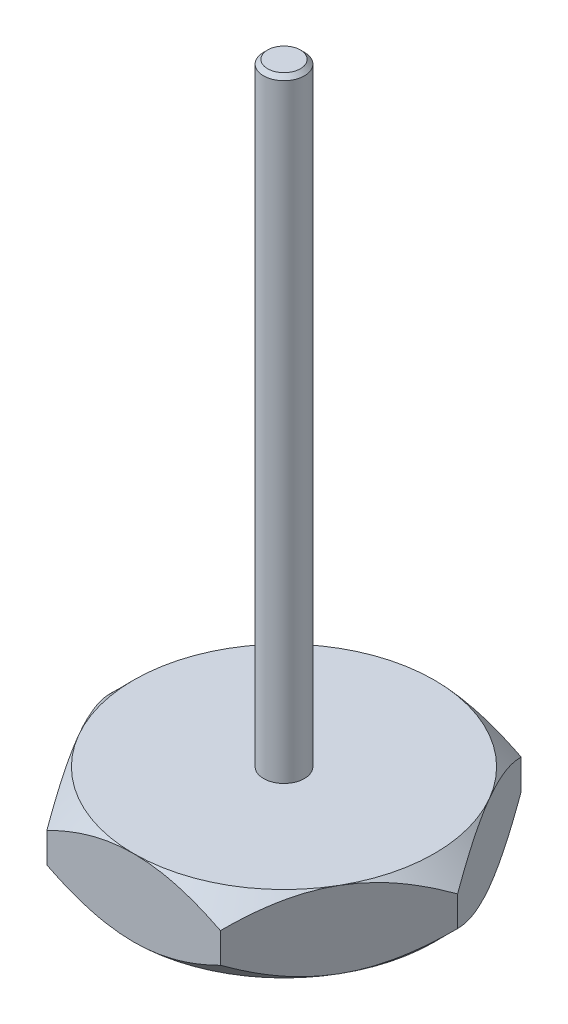
from build123d import *

# Parameters (mm, degrees)
BOSS_EXTRUDE1_DEPTH = 3.75
SKETCH1_3_R         = 1
BOSS_EXTRUDE2_DEPTH = 33.75
SKETCH2_OUTSIDE_W   = 100.258
SKETCH2_OUTSIDE_H   = 97.98
SKETCH2_OUTSIDE_R   = 7.361215932
CUT_EXTRUDE5_DEPTH  = 36.573866813
CUT_EXTRUDE5_DRAFT  = -45
CHAMFER1_SIZE       = 0.2
SKETCH3_OUTSIDE_W   = 93.188
SKETCH3_OUTSIDE_H   = 90.91
SKETCH3_OUTSIDE_R   = 7.361215932
CUT_EXTRUDE6_DEPTH  = 33.0380633
CUT_EXTRUDE6_DRAFT  = -45


with BuildPart() as part:
    # Sketch1 → Boss-Extrude1 (new body)
    with BuildSketch(Plane(origin=(0, 0, 0), x_dir=(1, 0, 0), z_dir=(0, 1, 0))):
        Polygon((-4.25, -7.361215932), (4.25, -7.361215932), (8.5, 0), (4.25, 7.361215932), (-4.25, 7.361215932), (-8.5, 0), align=None)
    extrude(amount=BOSS_EXTRUDE1_DEPTH)

    # Sketch1<3> → Boss-Extrude2 (add)
    with BuildSketch(Plane(origin=(0, 0, 0), x_dir=(1, 0, 0), z_dir=(0, 1, 0))):
        Circle(SKETCH1_3_R)
    extrude(amount=BOSS_EXTRUDE2_DEPTH)


with BuildPart() as cut_extrude5_tool:
    # Sketch2 outside → Cut-Extrude5 (with draft: the straight prism first)
    with BuildSketch(Plane.XZ):
        Rectangle(SKETCH2_OUTSIDE_W, SKETCH2_OUTSIDE_H)
        Circle(SKETCH2_OUTSIDE_R, mode=Mode.SUBTRACT)
    extrude(amount=-CUT_EXTRUDE5_DEPTH)
    # Cut-Extrude5: the draft: its side faces are tilted about the plane it starts from
    cut_extrude5_sides = [cut_extrude5_tool.faces().sort_by_distance(p)[0] for p in [
        (0, 18.286933406, -48.99),
        (50.129, 18.286933406, 0),
        (0, 18.286933406, 48.99),
        (-50.129, 18.286933406, 0),
        (-7.361215932, 18.286933406, 0),
    ]]
    draft(cut_extrude5_sides, Plane.XZ, CUT_EXTRUDE5_DRAFT)


with BuildPart() as part_1:
    add(part.part)

    # Cut-Extrude5: cut by cut_extrude5_tool
    add(cut_extrude5_tool.part, mode=Mode.SUBTRACT)

    # Chamfer1
    chamfer1_edges = [part_1.edges().sort_by_distance(p)[0] for p in [
        (-1, 33.75, 0),
    ]]
    chamfer(chamfer1_edges, length=CHAMFER1_SIZE)


with BuildPart() as cut_extrude6_tool:
    # Sketch3 outside → Cut-Extrude6 (with draft: the straight prism first)
    with BuildSketch(Plane(origin=(0, 3.75, 0), x_dir=(1, 0, 0), z_dir=(0, 1, 0))):
        Rectangle(SKETCH3_OUTSIDE_W, SKETCH3_OUTSIDE_H)
        Circle(SKETCH3_OUTSIDE_R, mode=Mode.SUBTRACT)
    extrude(amount=-CUT_EXTRUDE6_DEPTH)
    # Cut-Extrude6: the draft: its side faces are tilted about the plane it starts from
    cut_extrude6_sides = [cut_extrude6_tool.faces().sort_by_distance(p)[0] for p in [
        (0, -12.76903165, 45.455),
        (46.594, -12.76903165, 0),
        (0, -12.76903165, -45.455),
        (-46.594, -12.76903165, 0),
        (-7.361215932, -12.76903165, 0),
    ]]
    draft(cut_extrude6_sides, Plane(origin=(0, 3.75, 0), x_dir=(1, 0, 0), z_dir=(0, 1, 0)), CUT_EXTRUDE6_DRAFT)


with BuildPart() as part_2:
    add(part_1.part)

    # Cut-Extrude6: cut by cut_extrude6_tool
    add(cut_extrude6_tool.part, mode=Mode.SUBTRACT)


solid = part_2.part
